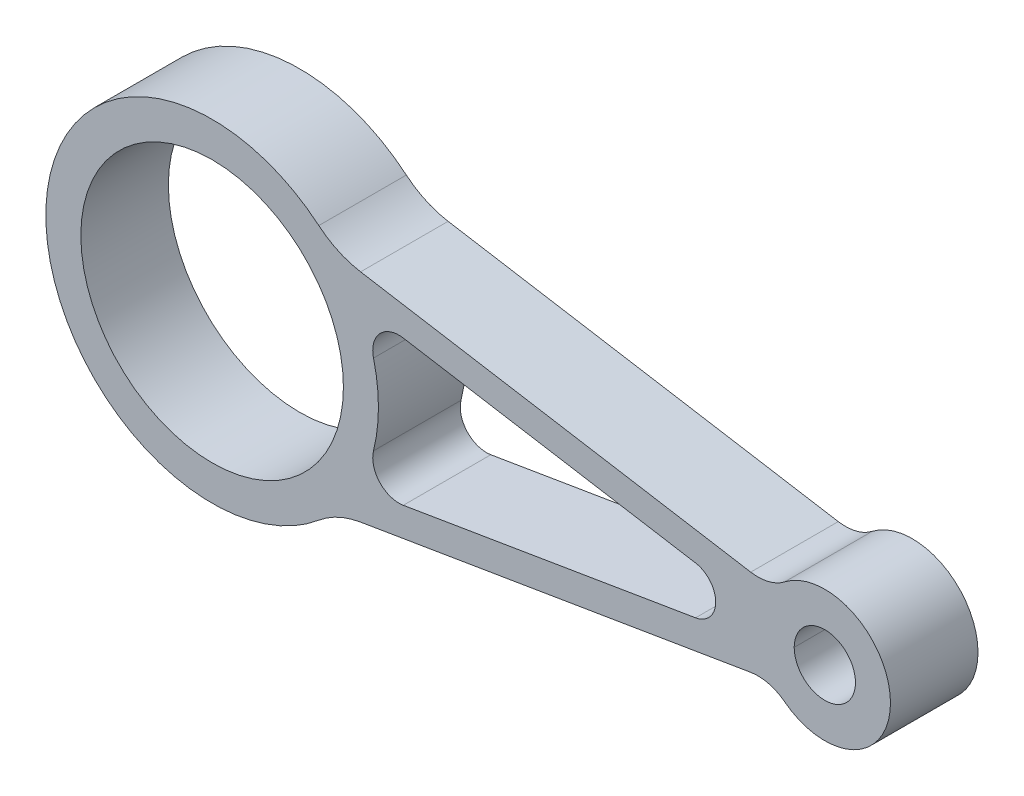
from build123d import *

# Parameters (mm, degrees)
SKETCH1_R           = 30
SKETCH1_R_2         = 7
BOSS_EXTRUDE1_DEPTH = 10
FILLET1_R           = 20
FILLET2_R           = 10
CUT_EXTRUDE1_DEPTH  = 161.838428244


with BuildPart() as part:
    # Sketch1 → Boss-Extrude1 (new, symmetric)
    with BuildSketch(Plane.XY):
        with BuildLine():
            Line((27.935473676, 25.760615491), (128.063755469, 9.084385863))
            ThreePointArc((128.063755469, 9.084385863), (155, 0), (128.063755469, -9.084385863))
            Line((128.063755469, -9.084385863), (27.935473676, -25.760615491))
            ThreePointArc((27.935473676, -25.760615491), (-38, 0), (27.935473676, 25.760615491))
        make_face()
        Circle(SKETCH1_R, mode=Mode.SUBTRACT)
        with Locations((140, 0)):
            Circle(SKETCH1_R_2, mode=Mode.SUBTRACT)
    extrude(amount=BOSS_EXTRUDE1_DEPTH, both=True)

    # Fillet1
    fillet1_edges = [part.edges().sort_by_distance(p)[0] for p in [
        (27.935473676, 25.760615491, 0),
        (27.935473676, -25.760615491, 0),
    ]]
    fillet(fillet1_edges, radius=FILLET1_R)

    # Fillet2
    fillet2_edges = [part.edges().sort_by_distance(p)[0] for p in [
        (128.063755469, 9.084385863, 0),
        (128.063755469, -9.084385863, 0),
    ]]
    fillet(fillet2_edges, radius=FILLET2_R)

    # Sketch3 → Cut-Extrude1 (cut, through all)
    with BuildSketch(Plane.XY.offset(10)):
        with BuildLine():
            Line((43.682358904, 16.548459765), (110.46878882, 5.425270378))
            ThreePointArc((110.46878882, 5.425270378), (115.065217391, 0), (110.46878882, -5.425270378))
            Line((110.46878882, -5.425270378), (43.682358904, -16.548459765))
            ThreePointArc((43.682358904, -16.548459765), (38.289832111, -14.701838037), (36.874374898, -9.180439854))
            ThreePointArc((36.874374898, -9.180439854), (38, 0), (36.874374898, 9.180439854))
            ThreePointArc((36.874374898, 9.180439854), (38.289832111, 14.701838037), (43.682358904, 16.548459765))
        make_face()
    extrude(amount=-CUT_EXTRUDE1_DEPTH, mode=Mode.SUBTRACT)


solid = part.part
